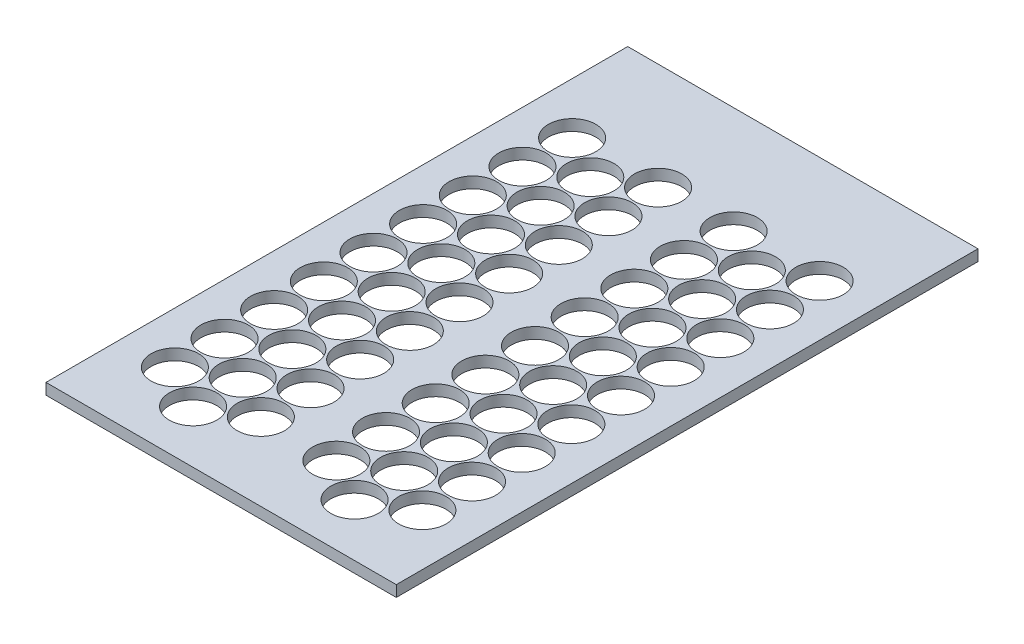
from build123d import *

# Parameters (mm, degrees)
SKETCH1_W           = 160.009432875
SKETCH1_H           = 265.731501048
SKETCH1_R           = 10.83850004
BOSS_EXTRUDE1_DEPTH = 5.08


with BuildPart() as part:
    # Sketch1 → Boss-Extrude1 (new body)
    with BuildSketch(Plane(origin=(0, 0, 0), x_dir=(1, 0, 0), z_dir=(0, 1, 0))):
        with Locations((16.238457681, 37.277575452)):
            Rectangle(SKETCH1_W, SKETCH1_H)
        with Locations(Location((-40.291258717, 121.268325936, 0), (0, 0, 270))):
            Circle(SKETCH1_R, mode=Mode.SUBTRACT)
        with Locations(Location((-20.652400538, 109.92982588, 0), (0, 0, 270))):
            Circle(SKETCH1_R, mode=Mode.SUBTRACT)
        with Locations(Location((-1.01354236, 121.268325936, 0), (0, 0, 270))):
            Circle(SKETCH1_R, mode=Mode.SUBTRACT)
        with Locations(Location((-40.291258717, 98.586125936, 0), (0, 0, 270))):
            Circle(SKETCH1_R, mode=Mode.SUBTRACT)
        with Locations(Location((-20.652400538, 87.24762588, 0), (0, 0, 270))):
            Circle(SKETCH1_R, mode=Mode.SUBTRACT)
        with Locations(Location((-1.01354236, 98.586125936, 0), (0, 0, 270))):
            Circle(SKETCH1_R, mode=Mode.SUBTRACT)
        with Locations(Location((-40.291258717, 75.903925936, 0), (0, 0, 270))):
            Circle(SKETCH1_R, mode=Mode.SUBTRACT)
        with Locations(Location((-20.652400538, 64.56542588, 0), (0, 0, 270))):
            Circle(SKETCH1_R, mode=Mode.SUBTRACT)
        with Locations(Location((-1.01354236, 75.903925936, 0), (0, 0, 270))):
            Circle(SKETCH1_R, mode=Mode.SUBTRACT)
        with Locations(Location((-40.291258717, 53.221725936, 0), (0, 0, 270))):
            Circle(SKETCH1_R, mode=Mode.SUBTRACT)
        with Locations(Location((-20.652400538, 41.88322588, 0), (0, 0, 270))):
            Circle(SKETCH1_R, mode=Mode.SUBTRACT)
        with Locations(Location((-1.01354236, 53.221725936, 0), (0, 0, 270))):
            Circle(SKETCH1_R, mode=Mode.SUBTRACT)
        with Locations(Location((-40.291258717, 30.539525936, 0), (0, 0, 270))):
            Circle(SKETCH1_R, mode=Mode.SUBTRACT)
        with Locations(Location((-20.652400538, 19.20102588, 0), (0, 0, 270))):
            Circle(SKETCH1_R, mode=Mode.SUBTRACT)
        with Locations(Location((-1.01354236, 30.539525936, 0), (0, 0, 270))):
            Circle(SKETCH1_R, mode=Mode.SUBTRACT)
        with Locations(Location((-40.291258717, 7.857325936, 0), (0, 0, 270))):
            Circle(SKETCH1_R, mode=Mode.SUBTRACT)
        with Locations(Location((-20.652400538, -3.48117412, 0), (0, 0, 270))):
            Circle(SKETCH1_R, mode=Mode.SUBTRACT)
        with Locations(Location((-1.01354236, 7.857325936, 0), (0, 0, 270))):
            Circle(SKETCH1_R, mode=Mode.SUBTRACT)
        with Locations(Location((-40.291258717, -14.824874064, 0), (0, 0, 270))):
            Circle(SKETCH1_R, mode=Mode.SUBTRACT)
        with Locations(Location((-20.652400538, -26.16337412, 0), (0, 0, 270))):
            Circle(SKETCH1_R, mode=Mode.SUBTRACT)
        with Locations(Location((-1.01354236, -14.824874064, 0), (0, 0, 270))):
            Circle(SKETCH1_R, mode=Mode.SUBTRACT)
        with Locations(Location((-40.291258717, -37.507074064, 0), (0, 0, 270))):
            Circle(SKETCH1_R, mode=Mode.SUBTRACT)
        with Locations(Location((-20.652400538, -48.84557412, 0), (0, 0, 270))):
            Circle(SKETCH1_R, mode=Mode.SUBTRACT)
        with Locations(Location((-1.01354236, -37.507074064, 0), (0, 0, 270))):
            Circle(SKETCH1_R, mode=Mode.SUBTRACT)
        with Locations(Location((-40.291258717, -60.189274064, 0), (0, 0, 270))):
            Circle(SKETCH1_R, mode=Mode.SUBTRACT)
        with Locations(Location((-20.652400538, -71.52777412, 0), (0, 0, 270))):
            Circle(SKETCH1_R, mode=Mode.SUBTRACT)
        with Locations(Location((-1.01354236, -60.189274064, 0), (0, 0, 270))):
            Circle(SKETCH1_R, mode=Mode.SUBTRACT)
        with Locations(Location((72.768174078, 7.857325936, 0), (0, 0, 90))):
            Circle(SKETCH1_R, mode=Mode.SUBTRACT)
        with Locations(Location((53.129315899, 19.20102588, 0), (0, 0, 90))):
            Circle(SKETCH1_R, mode=Mode.SUBTRACT)
        with Locations(Location((33.49045772, 7.857325936, 0), (0, 0, 90))):
            Circle(SKETCH1_R, mode=Mode.SUBTRACT)
        with Locations(Location((53.129315899, -3.48117412, 0), (0, 0, 90))):
            Circle(SKETCH1_R, mode=Mode.SUBTRACT)
        with Locations(Location((72.768174078, -14.824874064, 0), (0, 0, 90))):
            Circle(SKETCH1_R, mode=Mode.SUBTRACT)
        with Locations(Location((33.49045772, -14.824874064, 0), (0, 0, 90))):
            Circle(SKETCH1_R, mode=Mode.SUBTRACT)
        with Locations(Location((53.129315899, -26.16337412, 0), (0, 0, 90))):
            Circle(SKETCH1_R, mode=Mode.SUBTRACT)
        with Locations(Location((33.49045772, -37.507074064, 0), (0, 0, 90))):
            Circle(SKETCH1_R, mode=Mode.SUBTRACT)
        with Locations(Location((72.768174078, -37.507074064, 0), (0, 0, 90))):
            Circle(SKETCH1_R, mode=Mode.SUBTRACT)
        with Locations(Location((72.768174078, -60.189274064, 0), (0, 0, 90))):
            Circle(SKETCH1_R, mode=Mode.SUBTRACT)
        with Locations(Location((53.129315899, -48.84557412, 0), (0, 0, 90))):
            Circle(SKETCH1_R, mode=Mode.SUBTRACT)
        with Locations(Location((33.49045772, -60.189274064, 0), (0, 0, 90))):
            Circle(SKETCH1_R, mode=Mode.SUBTRACT)
        with Locations(Location((53.129315899, -71.52777412, 0), (0, 0, 90))):
            Circle(SKETCH1_R, mode=Mode.SUBTRACT)
        with Locations(Location((72.768174078, 30.539525936, 0), (0, 0, 90))):
            Circle(SKETCH1_R, mode=Mode.SUBTRACT)
        with Locations(Location((33.49045772, 30.539525936, 0), (0, 0, 90))):
            Circle(SKETCH1_R, mode=Mode.SUBTRACT)
        with Locations(Location((53.129315899, 41.88322588, 0), (0, 0, 90))):
            Circle(SKETCH1_R, mode=Mode.SUBTRACT)
        with Locations(Location((72.768174078, 53.221725936, 0), (0, 0, 90))):
            Circle(SKETCH1_R, mode=Mode.SUBTRACT)
        with Locations(Location((33.49045772, 53.221725936, 0), (0, 0, 90))):
            Circle(SKETCH1_R, mode=Mode.SUBTRACT)
        with Locations(Location((53.129315899, 64.56542588, 0), (0, 0, 90))):
            Circle(SKETCH1_R, mode=Mode.SUBTRACT)
        with Locations(Location((72.768174078, 75.903925936, 0), (0, 0, 90))):
            Circle(SKETCH1_R, mode=Mode.SUBTRACT)
        with Locations(Location((33.49045772, 75.903925936, 0), (0, 0, 90))):
            Circle(SKETCH1_R, mode=Mode.SUBTRACT)
        with Locations(Location((53.129315899, 87.24762588, 0), (0, 0, 90))):
            Circle(SKETCH1_R, mode=Mode.SUBTRACT)
        with Locations(Location((72.768174078, 98.586125936, 0), (0, 0, 90))):
            Circle(SKETCH1_R, mode=Mode.SUBTRACT)
        with Locations(Location((53.129315899, 109.92982588, 0), (0, 0, 90))):
            Circle(SKETCH1_R, mode=Mode.SUBTRACT)
        with Locations(Location((33.49045772, 98.586125936, 0), (0, 0, 90))):
            Circle(SKETCH1_R, mode=Mode.SUBTRACT)
        with Locations(Location((33.49045772, 121.268325936, 0), (0, 0, 90))):
            Circle(SKETCH1_R, mode=Mode.SUBTRACT)
        with Locations(Location((72.768174078, 121.268325936, 0), (0, 0, 90))):
            Circle(SKETCH1_R, mode=Mode.SUBTRACT)
    extrude(amount=BOSS_EXTRUDE1_DEPTH)


solid = part.part
